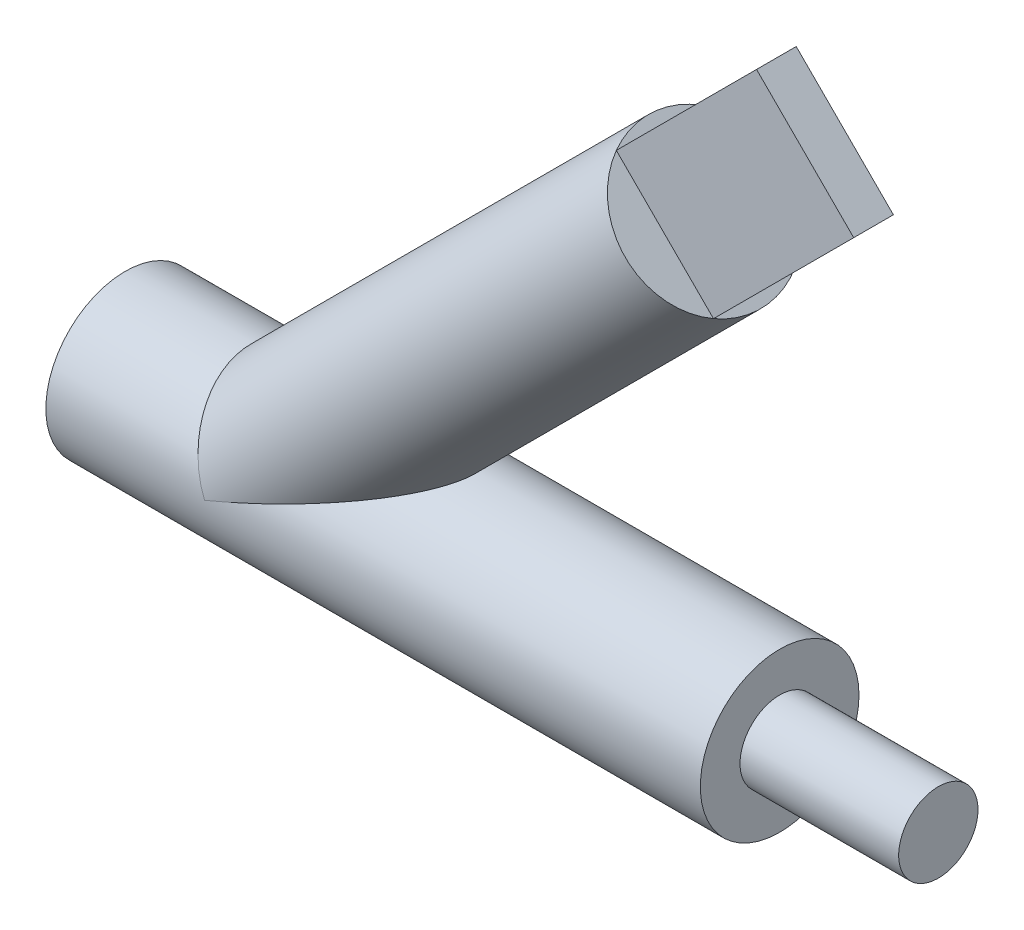
from build123d import *

# Parameters (mm, degrees)
SKETCH1_R           = 20
BOSS_EXTRUDE1_DEPTH = 165
SKETCH2_R           = 10
BOSS_EXTRUDE2_DEPTH = 40
SKETCH5_R           = 20
BOSS_EXTRUDE3_DEPTH = 150
SKETCH6_W           = 10
SKETCH6_H           = 34.641016151
BOSS_EXTRUDE5_DEPTH = 50
SKETCH7_R           = 5
CUT_EXTRUDE1_DEPTH  = 10


with BuildPart() as part:
    # Sketch1 → Boss-Extrude1 (new body)
    with BuildSketch(Plane(origin=(0, 0, 0), x_dir=(0, 0, -1), z_dir=(1, 0, 0))):
        Circle(SKETCH1_R)
    extrude(amount=BOSS_EXTRUDE1_DEPTH)

    # Sketch2 → Boss-Extrude2 (add)
    with BuildSketch(Plane(origin=(165, 0, 0), x_dir=(0, 0, -1), z_dir=(1, 0, 0))):
        Circle(SKETCH2_R)
    extrude(amount=BOSS_EXTRUDE2_DEPTH)

    # Sketch5 → Boss-Extrude3 (add)
    with BuildSketch(Plane(origin=(20, 20, 0), x_dir=(0.7071067811865464, -0.7071067811865488, 0), z_dir=(0.7071067811865488, 0.7071067811865464, 0))):
        with Locations(Location((28.284271247, 0, 0), (0, 0, 90))):
            Circle(SKETCH5_R)
    extrude(amount=BOSS_EXTRUDE3_DEPTH)

    # Sketch6 → Boss-Extrude5 (add)
    with BuildSketch(Plane(origin=(126.066017178, 126.066017178, 0), x_dir=(0, 0, -1), z_dir=(0.7071067811865487, 0.7071067811865465, 0))):
        with Locations((-5, -28.284271248)):
            Rectangle(SKETCH6_W, SKETCH6_H)
    extrude(amount=BOSS_EXTRUDE5_DEPTH)

    # Sketch7 → Cut-Extrude1 (cut)
    with BuildSketch(Plane.ZY):
        Circle(SKETCH7_R)
    extrude(amount=-CUT_EXTRUDE1_DEPTH, mode=Mode.SUBTRACT)


solid = part.part
